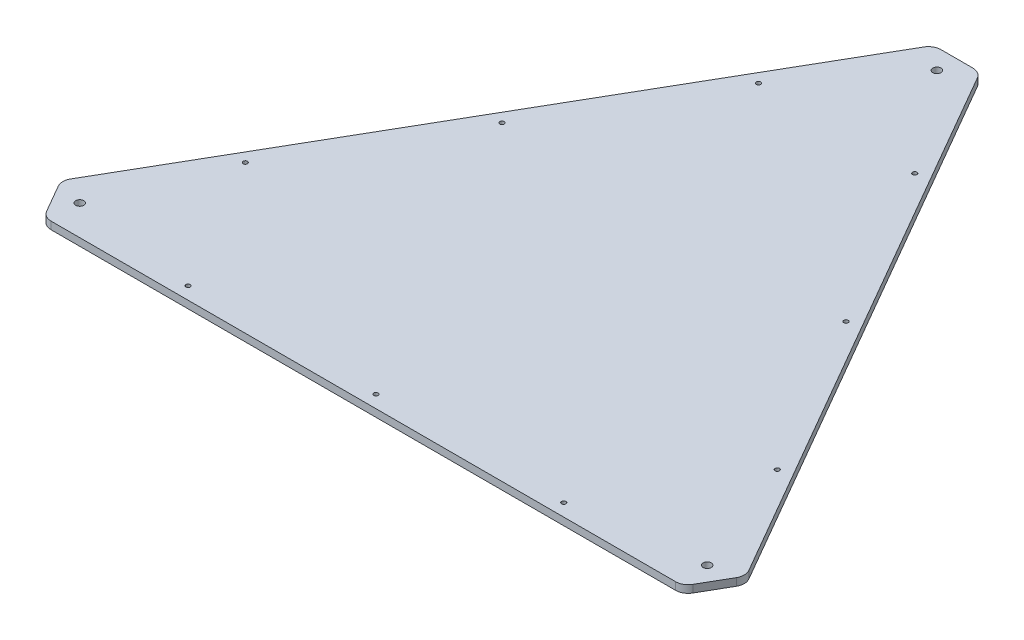
from build123d import *

# Parameters (mm, degrees)
SKETCH_1_R         = 3.25
EXTRUDE_1058_DEPTH = 3
FILLET_1_R         = 10
HOLE_WIZARD_3_2_D  = 3.5


with BuildPart() as part:
    # Эскиз1 → Extrude 1058 (new, symmetric)
    with BuildSketch(Plane(origin=(0, 0, 0), x_dir=(1, 0, 0), z_dir=(0, 1, 0))):
        Polygon((273.664027596, -136.63804004), (18.5, 305.31902002), (-18.5, 305.31902002), (-273.664027596, -136.63804004), (-255.164027596, -168.68097998), (255.164027596, -168.68097998), align=None)
        with Locations(Location((0, 289.31902002, 0), (0, 0, 270))):
            Circle(SKETCH_1_R, mode=Mode.SUBTRACT)
        with Locations(Location((-250.557621135, -144.65951001, 0), (0, 0, 270))):
            Circle(SKETCH_1_R, mode=Mode.SUBTRACT)
        with Locations(Location((250.557621135, -144.65951001, 0), (0, 0, 270))):
            Circle(SKETCH_1_R, mode=Mode.SUBTRACT)
    extrude(amount=EXTRUDE_1058_DEPTH, both=True)

    # Скругление1
    fillet_1_edges = [part.edges().sort_by_distance(p)[0] for p in [
        (255.164027596, 0, 168.68097998),
        (-255.164027596, 0, 168.68097998),
        (-273.664027596, 0, 136.63804004),
        (-18.5, 0, -305.31902002),
        (18.5, 0, -305.31902002),
        (273.664027596, 0, 136.63804004),
    ]]
    fillet(fillet_1_edges, radius=FILLET_1_R)

    # К Профилю 3,2мм (through all)
    with Locations(Plane(origin=(0, -3, 0), x_dir=(-1, 0, 0), z_dir=(0, -1, 0))):
        with Locations((150, -158.68097998), (0, -158.68097998), (-150, -158.68097998), (-212.42175976, -50.563320578), (-137.42175976, 79.34048999), (-62.42175976, 209.244300558), (62.42175976, 209.244300558), (137.42175976, 79.34048999), (212.42175976, -50.563320578)):
            Hole(HOLE_WIZARD_3_2_D / 2)


solid = part.part
